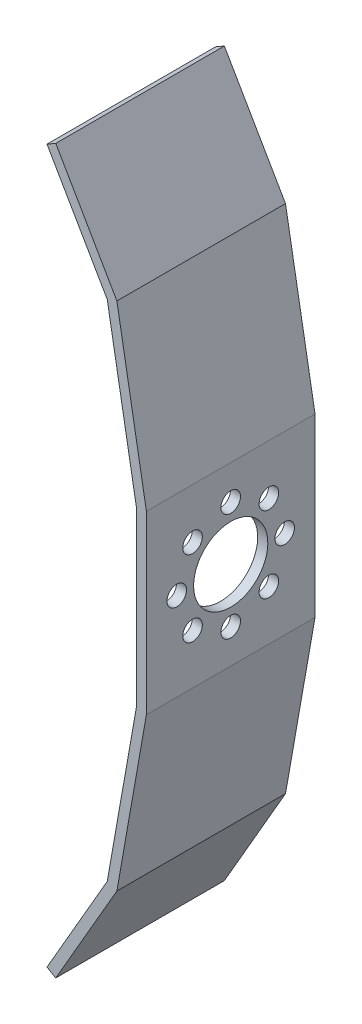
from build123d import *

# Parameters (mm, degrees)
EXTRUDE_1_DEPTH     = 25
SKETCH_2_R          = 5.5
SKETCH_2_R_2        = 1.45
CUT_EXTRUDE_1_DEPTH = 10


with BuildPart() as part:
    # 草图1 → 拉伸-薄壁1 (new body)
    with BuildSketch(Plane.XY):
        Polygon((-13.990723495, 52.833651093), (-5.056846112, 37.359721559), (-0.75, 12.934383502), (-0.75, -12.934383502), (-5.056846112, -37.359721559), (-13.990723495, -52.833651093), (-12.691685389, -53.583651093), (-3.625562771, -37.880666092), (0.75, -13.065616498), (0.75, 13.065616498), (-3.625562771, 37.880666092), (-12.691685389, 53.583651093), align=None)
    extrude(amount=EXTRUDE_1_DEPTH)

    # 草图2 → 切除-拉伸1 (cut)
    with BuildSketch(Plane(origin=(0.75, 0, 0), x_dir=(0, 0, -1), z_dir=(1, 0, 0))):
        with Locations(Location((-12.5, 0, 0), (0, 0, 90))):
            Circle(SKETCH_2_R)
        with Locations(Location((-20.5, 0, 0), (0, 0, 90))):
            Circle(SKETCH_2_R_2)
        with Locations(Location((-18.156854249, 5.656854249, 0), (0, 0, 90))):
            Circle(SKETCH_2_R_2)
        with Locations(Location((-12.5, 8, 0), (0, 0, 90))):
            Circle(SKETCH_2_R_2)
        with Locations(Location((-6.843145751, 5.656854249, 0), (0, 0, 90))):
            Circle(SKETCH_2_R_2)
        with Locations(Location((-4.5, 0, 0), (0, 0, 90))):
            Circle(SKETCH_2_R_2)
        with Locations(Location((-6.843145751, -5.656854249, 0), (0, 0, 90))):
            Circle(SKETCH_2_R_2)
        with Locations(Location((-12.5, -8, 0), (0, 0, 90))):
            Circle(SKETCH_2_R_2)
        with Locations(Location((-18.156854249, -5.656854249, 0), (0, 0, 90))):
            Circle(SKETCH_2_R_2)
    extrude(amount=-CUT_EXTRUDE_1_DEPTH, mode=Mode.SUBTRACT)


solid = part.part
